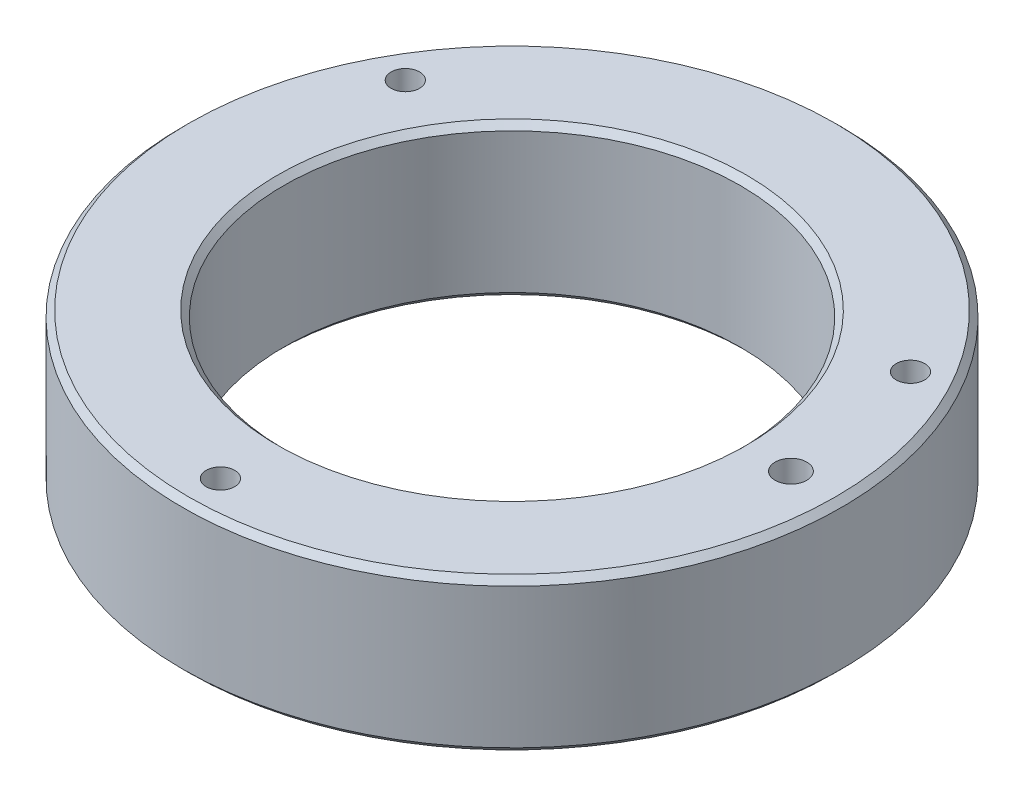
from build123d import *

# Parameters (mm, degrees)
SKETCH1_W                                        = 38.1
SKETCH1_H                                        = 25.3746
CHAMFER1_SIZE                                    = 1.524
CBORE_FOR_1_4_SOCKET_HEAD_CAP_SCREW1_D           = 7.1374
CBORE_FOR_1_4_SOCKET_HEAD_CAP_SCREW1_DEPTH       = 38.1
CBORE_FOR_1_4_SOCKET_HEAD_CAP_SCREW1_CBORE_D     = 11.1252
CBORE_FOR_1_4_SOCKET_HEAD_CAP_SCREW1_CBORE_DEPTH = 9.652
CBORE_FOR_1_4_SOCKET_HEAD_CAP_SCREW1_TIP         = 2.144291291
F_3_8_16_TAPPED_HOLE1_D                          = 7.9375
F_3_8_16_TAPPED_HOLE1_DEPTH                      = 38.1
F_3_8_16_TAPPED_HOLE1_TIP                        = 2.384665582


with BuildPart() as part:
    # Sketch1 → Revolve1 (revolve)
    with BuildSketch(Plane(origin=(0, 0, 0), x_dir=(0, 1, 0), z_dir=(0, 0, 1)), mode=Mode.PRIVATE) as revolve1_sk:
        with Locations((0, 69.8373)):
            Rectangle(SKETCH1_W, SKETCH1_H)
    revolve(revolve1_sk.sketch.rotate(Axis((0, -44.45, 0), (0, 1, 0)), 270), axis=Axis((0, -44.45, 0), (0, 1, 0)))

    # Chamfer1
    chamfer1_edges = [part.edges().sort_by_distance(p)[0] for p in [
        (0, -19.05, 57.15),
        (0, 19.05, 57.15),
        (0, 19.05, 82.5246),
        (0, -19.05, 82.5246),
    ]]
    chamfer(chamfer1_edges, length=CHAMFER1_SIZE)

    # CBORE for 1/4 Socket Head Cap Screw1
    with Locations(Plane(origin=(0, -19.05, 0), x_dir=(-1, 0, 0), z_dir=(0, -1, 0))):
        with Locations((0, -73.025), (-63.246, 36.5252), (63.246, 36.5252)):
            CounterBoreHole(CBORE_FOR_1_4_SOCKET_HEAD_CAP_SCREW1_D / 2, CBORE_FOR_1_4_SOCKET_HEAD_CAP_SCREW1_CBORE_D / 2, CBORE_FOR_1_4_SOCKET_HEAD_CAP_SCREW1_CBORE_DEPTH, depth=CBORE_FOR_1_4_SOCKET_HEAD_CAP_SCREW1_DEPTH)
            with Locations((0, 0, -(CBORE_FOR_1_4_SOCKET_HEAD_CAP_SCREW1_DEPTH + CBORE_FOR_1_4_SOCKET_HEAD_CAP_SCREW1_TIP / 2))):  # 118° drill point
                Cone(0, CBORE_FOR_1_4_SOCKET_HEAD_CAP_SCREW1_D / 2, CBORE_FOR_1_4_SOCKET_HEAD_CAP_SCREW1_TIP, mode=Mode.SUBTRACT)

    # 3/8-16 Tapped Hole1
    with Locations(Plane(origin=(0, -19.05, 0), x_dir=(-1, 0, 0), z_dir=(0, -1, 0))):
        with Locations((-69.85, 0)):
            Hole(F_3_8_16_TAPPED_HOLE1_D / 2, depth=F_3_8_16_TAPPED_HOLE1_DEPTH)
            with Locations((0, 0, -(F_3_8_16_TAPPED_HOLE1_DEPTH + F_3_8_16_TAPPED_HOLE1_TIP / 2))):  # 118° drill point
                Cone(0, F_3_8_16_TAPPED_HOLE1_D / 2, F_3_8_16_TAPPED_HOLE1_TIP, mode=Mode.SUBTRACT)


solid = part.part
